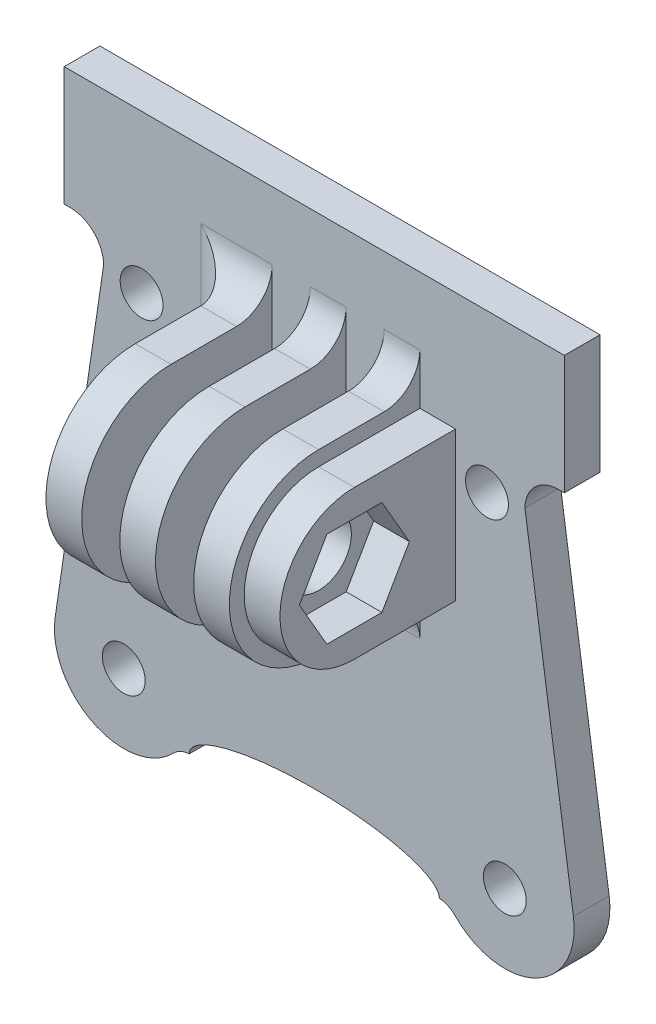
from build123d import *

# Parameters (mm, degrees)
SKETCH1_R           = 1.8
BOSS_EXTRUDE1_DEPTH = 3
SKETCH2_W           = 3
SKETCH2_H           = 15
BOSS_EXTRUDE2_DEPTH = 16
CUT_EXTRUDE1_REACH  = 97.261
SKETCH3_R           = 2.75
BOSS_EXTRUDE3_DEPTH = 3
FILLET1_R           = 3


with BuildPart() as part:
    # Sketch1 → Boss-Extrude1 (new body)
    with BuildSketch(Plane.XY):
        with BuildLine():
            Line((-22.166135034, -51.05300244), (-21.656424966, -51.05300244))
            ThreePointArc((-21.656424966, -51.05300244), (-19.69231813, -51.85743627), (-18.856778426, -53.808513627))
            Line((-18.856778426, -53.808513627), (-22.929080076, -81.483853258))
            ThreePointArc((-22.929080076, -81.483853258), (-19.743611023, -87.555563903), (-12.986896887, -86.389503303))
            ThreePointArc((-12.986896887, -86.389503303), (-12.38322773, -85.963624342), (-11.666135034, -85.785952153))
            add(Edge.make_bspline(
                [(9.333864966, -85.785952153), (9.333864966, -83.068352179), (-1.166135034, -83.068352179), (-11.666135034, -83.068352179), (-11.666135034, -85.785952153)],
                knots=[3.141592654, 3.141592654, 3.141592654, 4.71238898, 4.71238898, 6.283185307, 6.283185307, 6.283185307], degree=2, weights=[1, 0.707106781, 1, 0.707106781, 1]))
            ThreePointArc((9.333864966, -85.785952153), (10.050957661, -85.963624342), (10.654626818, -86.389503303))
            ThreePointArc((10.654626818, -86.389503303), (17.411340954, -87.555563903), (20.596810007, -81.483853258))
            Line((20.596810007, -81.483853258), (16.524508358, -53.808513627))
            ThreePointArc((16.524508358, -53.808513627), (17.360048061, -51.85743627), (19.324154897, -51.05300244))
            Line((19.324154897, -51.05300244), (19.833864966, -51.05300244))
            Line((19.833864966, -51.05300244), (19.833864966, -41.05300244))
            Line((19.833864966, -41.05300244), (-22.166135034, -41.05300244))
            Line((-22.166135034, -41.05300244), (-22.166135034, -51.05300244))
        make_face()
        with Locations((-15.666135034, -54.27800244)):
            Circle(SKETCH1_R, mode=Mode.SUBTRACT)
        with Locations((-17.166135034, -82.33184468)):
            Circle(SKETCH1_R, mode=Mode.SUBTRACT)
        with Locations((14.833864966, -82.33184468)):
            Circle(SKETCH1_R, mode=Mode.SUBTRACT)
        with Locations((13.333864966, -54.27800244)):
            Circle(SKETCH1_R, mode=Mode.SUBTRACT)
    extrude(amount=BOSS_EXTRUDE1_DEPTH)

    # Sketch2 → Boss-Extrude2 (add)
    with BuildSketch(Plane.XY.offset(3)):
        with Locations((0, -57.22115776)):
            Rectangle(SKETCH2_W, SKETCH2_H)
        with Locations((-6.2, -57.22115776)):
            Rectangle(SKETCH2_W, SKETCH2_H)
        with Locations((6.2, -57.22115776)):
            Rectangle(SKETCH2_W, SKETCH2_H)
    extrude(amount=BOSS_EXTRUDE2_DEPTH)

    # Sketch3 → Cut-Extrude1 (cut, up to next)
    with BuildSketch(Plane(origin=(7.7, 0, 0), x_dir=(0, 0, -1), z_dir=(1, 0, 0)), mode=Mode.PRIVATE) as cut_extrude1_sk1:
        with Locations((-11.5, -57.22115776)):
            Circle(SKETCH3_R)
    cut_extrude1_tool1 = extrude(cut_extrude1_sk1.sketch, amount=-CUT_EXTRUDE1_REACH, mode=Mode.PRIVATE) & part.part
    # Sketch3 → Cut-Extrude1 (cut, up to next)
    with BuildSketch(Plane(origin=(7.7, 0, 0), x_dir=(0, 0, -1), z_dir=(1, 0, 0)), mode=Mode.PRIVATE) as cut_extrude1_sk2:
        with BuildLine():
            ThreePointArc((-19, -57.22115776), (-16.803300859, -51.917856901), (-11.5, -49.72115776))
            Line((-11.5, -49.72115776), (-19, -49.72115776))
            Line((-19, -49.72115776), (-19, -57.22115776))
        make_face()
    cut_extrude1_tool2 = extrude(cut_extrude1_sk2.sketch, amount=-CUT_EXTRUDE1_REACH, mode=Mode.PRIVATE) & part.part
    # Sketch3 → Cut-Extrude1 (cut, up to next)
    with BuildSketch(Plane(origin=(7.7, 0, 0), x_dir=(0, 0, -1), z_dir=(1, 0, 0)), mode=Mode.PRIVATE) as cut_extrude1_sk3:
        with BuildLine():
            Line((-19, -64.72115776), (-11.5, -64.72115776))
            ThreePointArc((-11.5, -64.72115776), (-16.803300859, -62.524458619), (-19, -57.22115776))
            Line((-19, -57.22115776), (-19, -64.72115776))
        make_face()
    cut_extrude1_tool3 = extrude(cut_extrude1_sk3.sketch, amount=-CUT_EXTRUDE1_REACH, mode=Mode.PRIVATE) & part.part
    add(cut_extrude1_tool1.solids().sort_by_distance((7.7, -57.221158, 11.5))[0], mode=Mode.SUBTRACT)
    add(cut_extrude1_tool1.solids().sort_by_distance((7.7, -57.221158, 11.5))[1], mode=Mode.SUBTRACT)
    add(cut_extrude1_tool1.solids().sort_by_distance((7.7, -57.221158, 11.5))[2], mode=Mode.SUBTRACT)
    add(cut_extrude1_tool2.solids().sort_by_distance((7.7, -51.396417, 17.32474))[0], mode=Mode.SUBTRACT)
    add(cut_extrude1_tool2.solids().sort_by_distance((7.7, -51.396417, 17.32474))[1], mode=Mode.SUBTRACT)
    add(cut_extrude1_tool2.solids().sort_by_distance((7.7, -51.396417, 17.32474))[2], mode=Mode.SUBTRACT)
    add(cut_extrude1_tool3.solids().sort_by_distance((7.7, -63.045898, 17.32474))[0], mode=Mode.SUBTRACT)
    add(cut_extrude1_tool3.solids().sort_by_distance((7.7, -63.045898, 17.32474))[1], mode=Mode.SUBTRACT)
    add(cut_extrude1_tool3.solids().sort_by_distance((7.7, -63.045898, 17.32474))[2], mode=Mode.SUBTRACT)

    # Sketch4 → Boss-Extrude3 (add)
    with BuildSketch(Plane(origin=(7.7, 0, 0), x_dir=(0, 0, -1), z_dir=(1, 0, 0))):
        with BuildLine():
            Line((-3, -50.97115776), (-11.5, -50.97115776))
            ThreePointArc((-11.5, -50.97115776), (-17.75, -57.22115776), (-11.5, -63.47115776))
            Line((-11.5, -63.47115776), (-3, -63.47115776))
            Line((-3, -63.47115776), (-3, -50.97115776))
        make_face()
        Polygon((-9.190598923, -61.22115776), (-13.809401077, -61.22115776), (-16.118802154, -57.22115776), (-13.809401077, -53.22115776), (-9.190598923, -53.22115776), (-6.881197846, -57.22115776), align=None, mode=Mode.SUBTRACT)
    extrude(amount=BOSS_EXTRUDE3_DEPTH)

    # Fillet1
    fillet1_edges = [part.edges().sort_by_distance(p)[0] for p in [
        (0, -49.72115776, 3),
        (0, -64.72115776, 3),
        (-6.2, -49.72115776, 3),
        (-7.7, -57.22115776, 3),
        (-6.2, -64.72115776, 3),
        (6.2, -49.72115776, 3),
        (6.2, -64.72115776, 3),
    ]]
    fillet(fillet1_edges, radius=FILLET1_R)


solid = part.part
